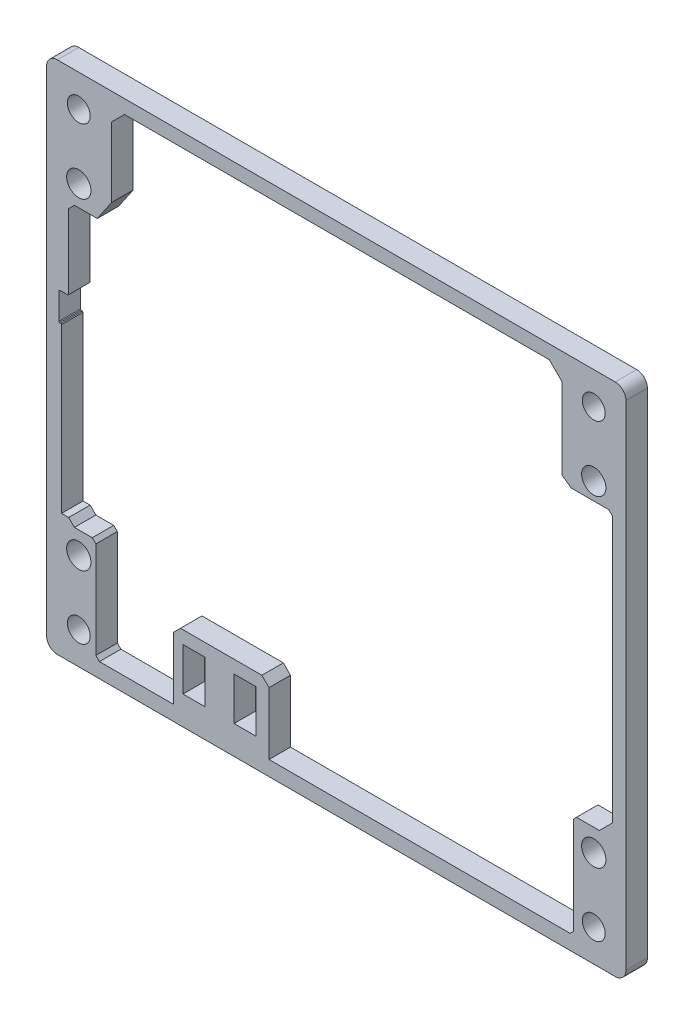
from build123d import *

# Parameters (mm, degrees)
MODEL_R                 = 1.7
MODEL_R_2               = 1.600279216
MODEL_W                 = 3.1
MODEL_H                 = 6
SALIENTE_EXTRUIR1_DEPTH = 3


with BuildPart() as part:
    # Model → Saliente-Extruir1 (new body)
    with BuildSketch(Plane.XY):
        with BuildLine():
            Line((139.768153306, -45.054934941), (61.763543448, -45.054934941))
            ThreePointArc((61.763543448, -45.054934941), (60.702883276, -45.494274769), (60.263543448, -46.554934941))
            Line((60.263543448, -46.554934941), (60.263543448, -115.557339175))
            ThreePointArc((60.263543448, -115.557339175), (60.702883276, -116.617999347), (61.763543448, -117.057339175))
            Line((61.763543448, -117.057339175), (139.768153306, -117.057339175))
            ThreePointArc((139.768153306, -117.057339175), (140.828813478, -116.617999347), (141.268153306, -115.557339175))
            Line((141.268153306, -115.557339175), (141.268153306, -46.554934941))
            ThreePointArc((141.268153306, -46.554934941), (140.828813478, -45.494274769), (139.768153306, -45.054934941))
        make_face()
        with Locations((136.768487808, -103.558008179)):
            Circle(MODEL_R, mode=Mode.SUBTRACT)
        with Locations((136.768487808, -58.554600438)):
            Circle(MODEL_R, mode=Mode.SUBTRACT)
        with Locations((136.768487808, -112.557673677)):
            Circle(MODEL_R_2, mode=Mode.SUBTRACT)
        with Locations((136.768487808, -49.554934941)):
            Circle(MODEL_R_2, mode=Mode.SUBTRACT)
        with Locations((64.763543448, -103.558008179)):
            Circle(MODEL_R, mode=Mode.SUBTRACT)
        with Locations((64.763543448, -58.554600438)):
            Circle(MODEL_R, mode=Mode.SUBTRACT)
        with Locations((64.763543448, -49.554934941)):
            Circle(MODEL_R_2, mode=Mode.SUBTRACT)
        with Locations((64.763543448, -112.557673677)):
            Circle(MODEL_R_2, mode=Mode.SUBTRACT)
        with Locations((80.876831082, -110.067386969)):
            Rectangle(MODEL_W, MODEL_H, mode=Mode.SUBTRACT)
        with Locations((88.022204789, -110.067386969)):
            Rectangle(MODEL_W, MODEL_H, mode=Mode.SUBTRACT)
        Polygon((63.351345037, -62.275422733), (63.351345037, -72.689428622), (63.251345037, -72.789428622), (62.088360478, -72.789428622), (61.988360478, -72.889428622), (61.988360478, -76.624152209), (62.088360478, -76.724152209), (62.251345037, -76.724152209), (62.351345037, -76.824152209), (62.351345037, -99.677826967), (63.351345037, -99.677826967), (64.151345037, -100.477826967), (66.651345037, -100.477826967), (67.151345037, -100.977826967), (67.151345037, -114.477826967), (67.651345037, -114.977826967), (77.980472194, -114.977826967), (77.980472194, -106.277895967), (78.980472194, -105.277865819), (90.361604846, -105.277522697), (91.361604845, -106.277492548), (91.361604845, -114.977826967), (133.468205597, -114.977826967), (133.968205597, -114.477826967), (133.968205597, -100.862451961), (134.355954895, -100.477826967), (137.555954895, -100.477826967), (139.366374234, -98.667407629), (139.366374234, -61.475422733), (138.866374234, -60.975422733), (133.634687553, -60.975422733), (132.355954895, -60.088974267), (132.355954895, -48.775422733), (130.555954895, -46.975422733), (71.151345037, -46.975422733), (69.351345037, -48.775422733), (69.351345037, -58.538415371), (67.351345037, -61.475422733), (64.151345037, -61.475422733), align=None, mode=Mode.SUBTRACT)
    extrude(amount=SALIENTE_EXTRUIR1_DEPTH)


solid = part.part
